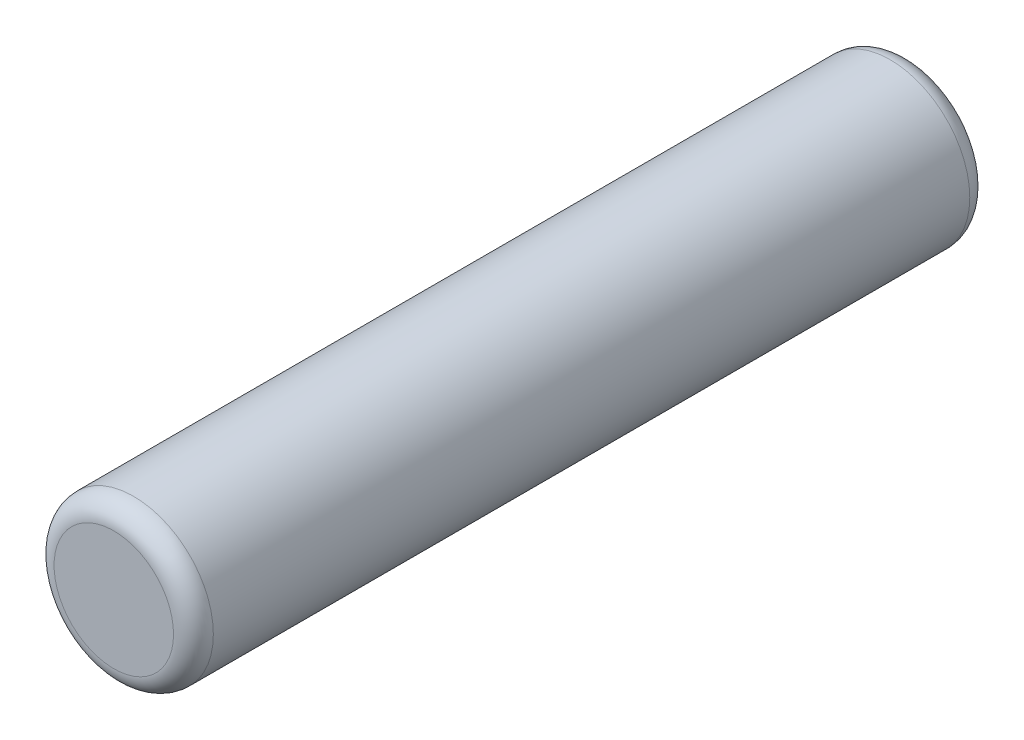
from build123d import *

# Parameters (mm, degrees)
ESQUISSE1_R        = 1
BOSS_EXTRU_1_DEPTH = 10
CONG_1_R           = 0.25


with BuildPart() as part:
    # Esquisse1 → Boss.-Extru.1 (new body)
    with BuildSketch(Plane.XY):
        Circle(ESQUISSE1_R)
    extrude(amount=BOSS_EXTRU_1_DEPTH)

    # Congé1
    cong_1_edges = [part.edges().sort_by_distance(p)[0] for p in [
        (-1, 0, 0),
        (-1, 0, 10),
    ]]
    fillet(cong_1_edges, radius=CONG_1_R)


solid = part.part
